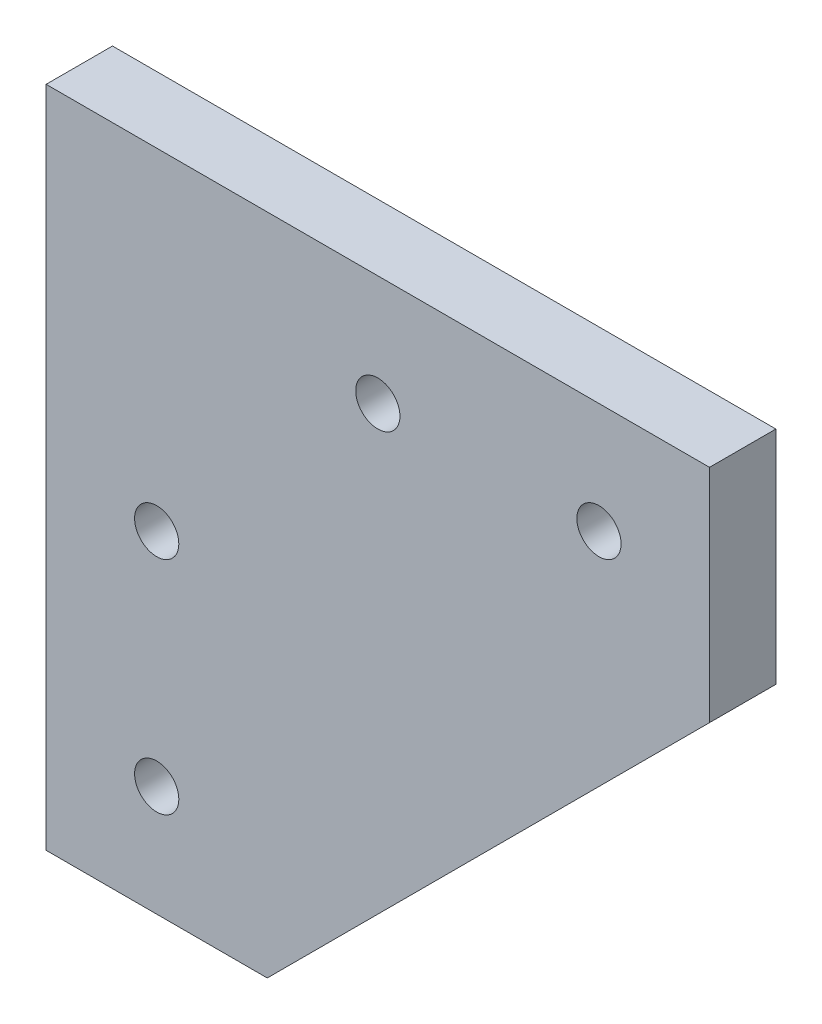
from build123d import *

# Parameters (mm, degrees)
SKETCH1_R           = 2
BOSS_EXTRUDE1_DEPTH = 6


with BuildPart() as part:
    # Sketch1 → Boss-Extrude1 (new body)
    with BuildSketch(Plane.XY):
        Polygon((20, -60), (60, -20), (60, 0), (0, 0), (0, -60), align=None)
        with Locations((50, -10)):
            Circle(SKETCH1_R, mode=Mode.SUBTRACT)
        with Locations((30, -10)):
            Circle(SKETCH1_R, mode=Mode.SUBTRACT)
        with Locations((10, -50)):
            Circle(SKETCH1_R, mode=Mode.SUBTRACT)
        with Locations((10, -30)):
            Circle(SKETCH1_R, mode=Mode.SUBTRACT)
    extrude(amount=BOSS_EXTRUDE1_DEPTH)


solid = part.part
